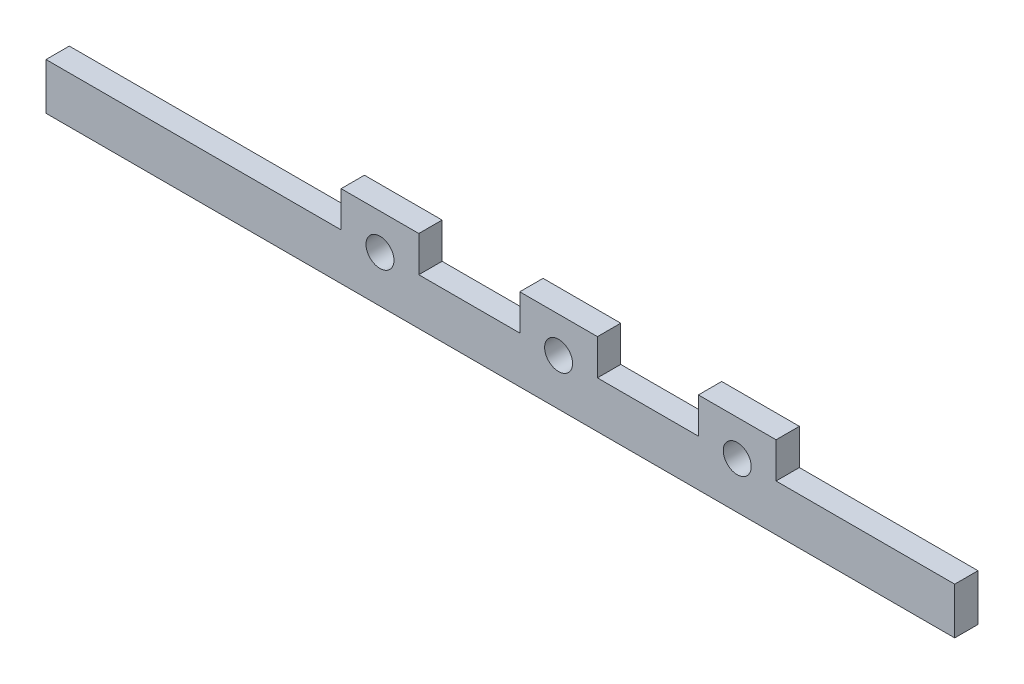
from build123d import *

# Parameters (mm, degrees)
CROQUIS1_R              = 9
SALIENTE_EXTRUIR1_DEPTH = 15


with BuildPart() as part:
    # Croquis1 → Saliente-Extruir1 (new body)
    with BuildSketch(Plane.XY):
        Polygon((-292.5, 0), (292.5, 0), (292.5, 30), (177.5, 30), (177.5, 53), (127.5, 53), (127.5, 30), (62.5, 30), (62.5, 53), (12.5, 53), (12.5, 30), (-52.5, 30), (-52.5, 53), (-102.5, 53), (-102.5, 30), (-292.5, 30), align=None)
        with Locations((37.5, 30)):
            Circle(CROQUIS1_R, mode=Mode.SUBTRACT)
        with Locations((-77.5, 30)):
            Circle(CROQUIS1_R, mode=Mode.SUBTRACT)
        with Locations((152.5, 30)):
            Circle(CROQUIS1_R, mode=Mode.SUBTRACT)
    extrude(amount=SALIENTE_EXTRUIR1_DEPTH)


solid = part.part
